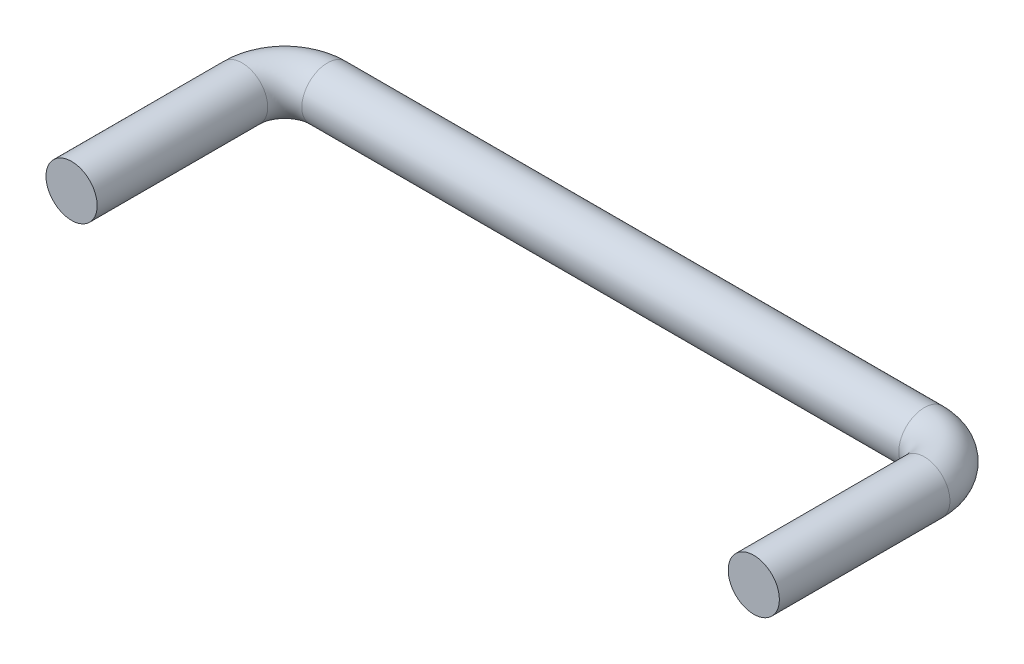
from build123d import *

# Parameters (mm, degrees)
SZKIC3_R = 3


with BuildPart() as part:
    # Wyciągnięcie po ścieżce4: sweep along a path in Szkic1
    with BuildLine(Plane(origin=(0, 0, 0), x_dir=(1, 0, 0), z_dir=(0, 1, 0))) as wyci_gni_cie_po_cie_ce4_path:
        Line((-100, -50), (-100, -30))
        ThreePointArc((-100, -30), (-98.535533906, -26.464466094), (-95, -25))
        Line((-95, -25), (-25, -25))
        ThreePointArc((-25, -25), (-21.464466094, -26.464466094), (-20, -30))
        Line((-20, -30), (-20, -50))
    # Szkic3 → Wyciągnięcie po ścieżce4 (sweep)
    with BuildSketch(Plane(origin=(-100, 0, 50), x_dir=(-1, 0, 0), z_dir=(0, 0, -1))):
        Circle(SZKIC3_R)
    sweep(path=wyci_gni_cie_po_cie_ce4_path.line)


solid = part.part
